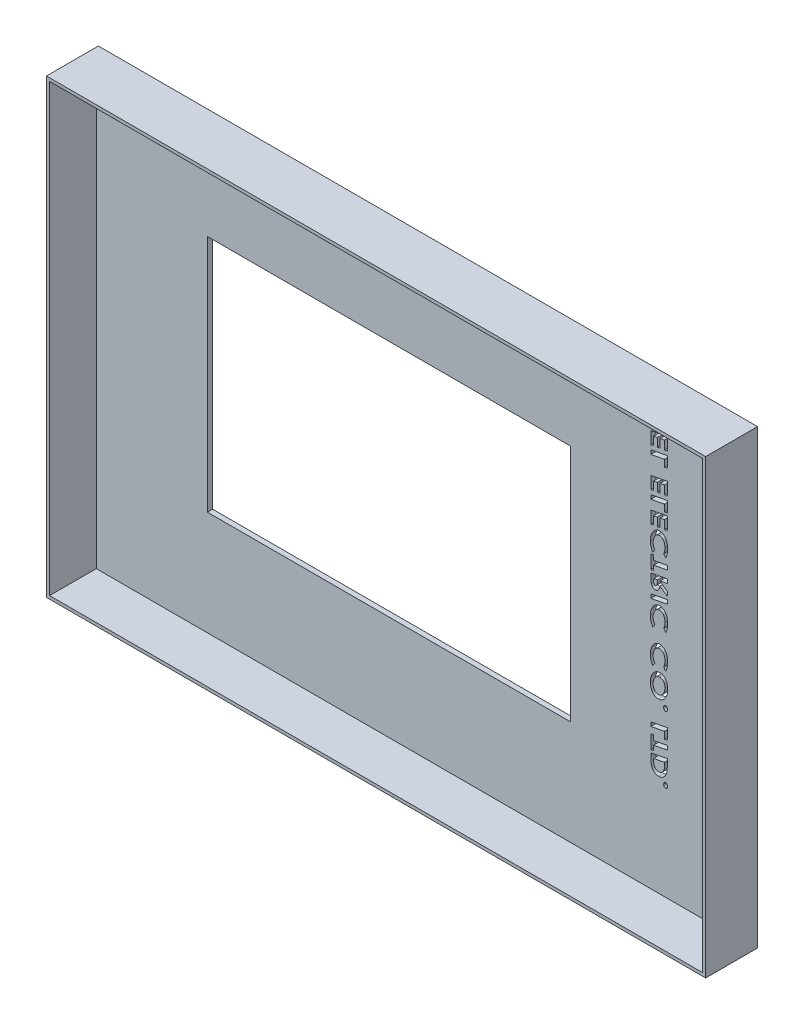
from build123d import *

# Parameters (mm, degrees)
SKETCH1_W           = 127
SKETCH1_H           = 87
SKETCH1_W_2         = 70
SKETCH1_H_2         = 45
BOSS_EXTRUDE1_DEPTH = 10
SKETCH2_W           = 125.8
SKETCH2_H           = 85.8
CUT_EXTRUDE1_DEPTH  = 9
SKETCH3_W           = 70
SKETCH3_H           = 45
CUT_EXTRUDE2_DEPTH  = 9


with BuildPart() as part:
    # Sketch1 → Boss-Extrude1 (new body)
    with BuildSketch(Plane.XY):
        with Locations((15.151215805, -8.661854103)):
            Rectangle(SKETCH1_W, SKETCH1_H)
        with Locations((8.651215805, -8.934429786)):
            Rectangle(SKETCH1_W_2, SKETCH1_H_2, mode=Mode.SUBTRACT)
    extrude(amount=BOSS_EXTRUDE1_DEPTH)

    # Sketch2 → Cut-Extrude1 (cut)
    with BuildSketch(Plane.XY.offset(10)):
        with Locations((15.151215805, -8.661854103)):
            Rectangle(SKETCH2_W, SKETCH2_H)
    extrude(amount=-CUT_EXTRUDE1_DEPTH, mode=Mode.SUBTRACT)

    # Sketch3 → Cut-Extrude2 (cut)
    # profile 1 of 21: a face of its own
    with BuildSketch(Plane(origin=(0, 0, 0), x_dir=(-1, 0, 0), z_dir=(0, 0, -1))):
        with Locations((-8.651215805, -7.938571366)):
            Rectangle(SKETCH3_W, SKETCH3_H)
    # profile 2 of 21: a face of its own
    with BuildSketch(Plane(origin=(0, 0, 0), x_dir=(-1, 0, 0), z_dir=(0, 0, -1))):
        with BuildLine():
            Line((-59.082117383, 34.027223421), (-59.082117383, 33.269726426))
            add(Edge.make_bspline(
                [(-59.082117383, 33.269726426), (-59.082281705, 33.214389143), (-59.082598447, 33.10772301), (-59.087222218, 32.954203937), (-59.094033499, 32.813175952), (-59.10344359, 32.685074316), (-59.115121237, 32.569376597), (-59.130416089, 32.466721027), (-59.14738296, 32.376206554), (-59.16314809, 32.321119835), (-59.170523833, 32.295347419)],
                knots=[0, 0, 0, 0, 1.353389102, 2.608743628, 3.756101744, 4.806405415, 5.750091809, 6.599269946, 7.344666056, 8, 8, 8, 8], degree=3))
            add(Edge.make_bspline(
                [(-59.170523833, 32.295347419), (-59.179710854, 32.26681277), (-59.197647814, 32.211101032), (-59.229885614, 32.131488105), (-59.264077544, 32.056883702), (-59.300996758, 31.987416608), (-59.340244289, 31.923083946), (-59.382423523, 31.864094565), (-59.427460533, 31.810647833), (-59.475462056, 31.762707565), (-59.525576689, 31.720042703), (-59.577901531, 31.682940202), (-59.632180729, 31.651591615), (-59.688569512, 31.625889243), (-59.747390949, 31.606012208), (-59.808416788, 31.592507636), (-59.871317046, 31.5827572), (-59.913989581, 31.582079624), (-59.93565304, 31.58173564)],
                knots=[0, 0, 0, 0, 1.276660213, 2.492582227, 3.656403132, 4.771545786, 5.841900154, 6.864511781, 7.857869233, 8.815819527, 9.751368605, 10.658498021, 11.544612112, 12.417650074, 13.294463908, 14.183977485, 15.078064426, 16, 16, 16, 16], degree=3))
            add(Edge.make_bspline(
                [(-59.93565304, 31.58173564), (-59.959431517, 31.582305882), (-60.006786131, 31.583441512), (-60.076741329, 31.593816113), (-60.144767079, 31.611346677), (-60.211317532, 31.634889718), (-60.276341978, 31.665498277), (-60.33932231, 31.703371178), (-60.400802657, 31.747374671), (-60.459535584, 31.798451164), (-60.516171299, 31.854540559), (-60.56794021, 31.916621383), (-60.616852014, 31.982364306), (-60.661152004, 32.053142404), (-60.702071397, 32.128485905), (-60.738779524, 32.208395682), (-60.771270148, 32.2930008), (-60.800583245, 32.383497212), (-60.825543255, 32.484468397), (-60.847487665, 32.598685738), (-60.866330412, 32.728156906), (-60.881984123, 32.872638741), (-60.894536665, 33.032142444), (-60.903712669, 33.206903173), (-60.910932391, 33.396666012), (-60.912852685, 33.528366746), (-60.913848152, 33.596639486)],
                knots=[0, 0, 0, 0, 0.688190827, 1.37052554, 2.041977379, 2.71957408, 3.41155978, 4.119000826, 4.844714822, 5.597744924, 6.37036061, 7.150040052, 7.935785256, 8.741326349, 9.565342852, 10.416796577, 11.285446487, 12.188132211, 13.169247335, 14.294861793, 15.55450045, 16.956352973, 18.501986645, 20.186439608, 22.023076926, 24, 24, 24, 24], degree=3))
            Line((-60.913848152, 33.596639486), (-62.257117383, 33.853590608))
            Line((-62.257117383, 33.853590608), (-62.257117383, 34.634620256))
            Line((-62.257117383, 34.634620256), (-59.082117383, 34.027223421))
        make_face()
        with BuildLine():
            add(Edge.make_bspline(
                [(-60.384681485, 33.494876666), (-60.384010222, 33.438480919), (-60.382727995, 33.33075554), (-60.378127954, 33.176755292), (-60.369195299, 33.038050622), (-60.357543886, 32.91473616), (-60.342331358, 32.806711971), (-60.324813557, 32.71379399), (-60.302548877, 32.636438765), (-60.27807618, 32.572598986), (-60.247974525, 32.521231007), (-60.216995847, 32.47652916), (-60.182136562, 32.43871594), (-60.14324807, 32.408403774), (-60.101483949, 32.384570028), (-60.056347969, 32.367085845), (-60.007777729, 32.356773727), (-59.974287143, 32.355685682), (-59.957277639, 32.355133076)],
                knots=[0, 0, 0, 0, 2.01570491, 3.850336042, 5.505520641, 6.982487919, 8.275845569, 9.403696488, 10.358095419, 11.150243365, 11.83912391, 12.480353238, 13.091510883, 13.669004126, 14.235709656, 14.804185275, 15.392658741, 16, 16, 16, 16], degree=3))
            add(Edge.make_bspline(
                [(-59.957277639, 32.355133076), (-59.938303657, 32.356044155), (-59.900923794, 32.357839035), (-59.847298148, 32.374058721), (-59.799113801, 32.402003431), (-59.755377909, 32.439163363), (-59.717444131, 32.487447027), (-59.685945505, 32.545844899), (-59.660569054, 32.614150203), (-59.645084989, 32.67879432), (-59.635134863, 32.739312639), (-59.629216797, 32.796250471), (-59.623370875, 32.863235322), (-59.619290886, 32.940459422), (-59.615290699, 33.027584085), (-59.61288525, 33.124914278), (-59.611785423, 33.232410699), (-59.611456132, 33.307463229), (-59.61128405, 33.346684559)],
                knots=[0, 0, 0, 0, 0.784179952, 1.544880747, 2.291583166, 3.075910414, 3.906448518, 4.817636112, 5.811880456, 6.914401306, 7.563619973, 8.349565657, 9.283129306, 10.346755864, 11.550169543, 12.893299621, 14.376484841, 16, 16, 16, 16], degree=3))
            Line((-59.61128405, 33.346684559), (-60.384681485, 33.494876666))
        make_face(mode=Mode.SUBTRACT)
    # profile 3 of 21: a face of its own
    with BuildSketch(Plane(origin=(0, 0, 0), x_dir=(-1, 0, 0), z_dir=(0, 0, -1))):
        Polygon((-59.082117383, 30.64869778), (-59.082117383, 29.867668132), (-62.257117383, 30.475064967), (-62.257117383, 31.256094615), align=None)
    # profile 4 of 21: a face of its own
    with BuildSketch(Plane(origin=(0, 0, 0), x_dir=(-1, 0, 0), z_dir=(0, 0, -1))):
        Polygon((-59.082117383, 29.038301145), (-59.082117383, 28.189217611), (-60.057768425, 27.579912724), (-59.082117383, 26.629066369), (-59.082117383, 25.679492051), (-60.651808889, 27.209114446), (-62.257117383, 26.206114647), (-62.257117383, 27.055834198), (-61.182883609, 27.726196778), (-62.257117383, 28.773081794), (-62.257117383, 29.722656113), (-60.588843144, 28.097631073), align=None)
    # profile 5 of 21: a face of its own
    with BuildSketch(Plane(origin=(0, 0, 0), x_dir=(-1, 0, 0), z_dir=(0, 0, -1))):
        Polygon((-59.082117383, 24.909274703), (-59.082117383, 22.545197179), (-59.61128405, 22.630423541), (-59.61128405, 24.230007876), (-60.343976357, 24.369931754), (-60.343976357, 22.748086802), (-60.873143024, 22.833313164), (-60.873143024, 24.471058557), (-61.727950716, 24.634515087), (-61.727950716, 22.970056954), (-62.257117383, 23.055283317), (-62.257117383, 25.516671538), align=None)
    # profile 6 of 21: a face of its own
    with BuildSketch(Plane(origin=(0, 0, 0), x_dir=(-1, 0, 0), z_dir=(0, 0, -1))):
        Polygon((-59.082117383, 21.693569575), (-59.082117383, 20.912539927), (-61.727950716, 21.418809959), (-61.727950716, 20.102889486), (-62.257117383, 20.197020095), (-62.257117383, 22.300966409), align=None)
    # profile 7 of 21: a face of its own
    with BuildSketch(Plane(origin=(0, 0, 0), x_dir=(-1, 0, 0), z_dir=(0, 0, -1))):
        Polygon((-59.082117383, 17.419531113), (-59.082117383, 15.055453589), (-59.61128405, 15.140679951), (-59.61128405, 16.740264286), (-60.343976357, 16.880188164), (-60.343976357, 15.258343212), (-60.873143024, 15.343569575), (-60.873143024, 16.981314967), (-61.727950716, 17.144771498), (-61.727950716, 15.480313365), (-62.257117383, 15.565539727), (-62.257117383, 18.026927948), align=None)
    # profile 8 of 21: a face of its own
    with BuildSketch(Plane(origin=(0, 0, 0), x_dir=(-1, 0, 0), z_dir=(0, 0, -1))):
        Polygon((-59.082117383, 14.203825985), (-59.082117383, 13.422796337), (-61.727950716, 13.929066369), (-61.727950716, 12.613145897), (-62.257117383, 12.707276506), (-62.257117383, 14.81122282), align=None)
    # profile 9 of 21: a face of its own
    with BuildSketch(Plane(origin=(0, 0, 0), x_dir=(-1, 0, 0), z_dir=(0, 0, -1))):
        Polygon((-59.082117383, 11.639402908), (-59.082117383, 9.275325384), (-59.61128405, 9.360551746), (-59.61128405, 10.960136081), (-60.343976357, 11.100059959), (-60.343976357, 9.478215007), (-60.873143024, 9.563441369), (-60.873143024, 11.201186762), (-61.727950716, 11.364643292), (-61.727950716, 9.700185159), (-62.257117383, 9.785411522), (-62.257117383, 12.246799743), align=None)
    # profile 10 of 21: a face of its own
    with BuildSketch(Plane(origin=(0, 0, 0), x_dir=(-1, 0, 0), z_dir=(0, 0, -1))):
        with BuildLine():
            Line((-59.481536453, 4.767868453), (-59.875231365, 5.366997059))
            add(Edge.make_bspline(
                [(-59.875231365, 5.366997059), (-59.848355085, 5.400561155), (-59.793860494, 5.468616025), (-59.725853107, 5.583001145), (-59.666122741, 5.707180977), (-59.617246147, 5.841771645), (-59.577716864, 5.984621246), (-59.550034939, 6.134435713), (-59.533197508, 6.290108109), (-59.530993163, 6.395818945), (-59.529873793, 6.449499062)],
                knots=[0, 0, 0, 0, 0.889190196, 1.802930154, 2.747117594, 3.738502628, 4.762768697, 5.81204048, 6.88895098, 8, 8, 8, 8], degree=3))
            add(Edge.make_bspline(
                [(-59.529873793, 6.449499062), (-59.530323062, 6.487462257), (-59.531220167, 6.563267661), (-59.539682802, 6.67621808), (-59.553849061, 6.788026965), (-59.572962499, 6.898586517), (-59.596765192, 7.008323772), (-59.627730247, 7.116374588), (-59.663330759, 7.223343636), (-59.703711522, 7.328562172), (-59.749083765, 7.429977155), (-59.798396816, 7.526406051), (-59.850094873, 7.617505896), (-59.906307609, 7.702420699), (-59.966230077, 7.781243815), (-60.028957949, 7.854882612), (-60.096366068, 7.92156577), (-60.165702147, 7.983424063), (-60.238291673, 8.037883344), (-60.31188098, 8.085784326), (-60.386944551, 8.1262693), (-60.463073298, 8.159395962), (-60.540801004, 8.185064866), (-60.619518294, 8.20354097), (-60.699618065, 8.214652616), (-60.753325615, 8.216210208), (-60.78028445, 8.216992051)],
                knots=[0, 0, 0, 0, 1.147840019, 2.292021974, 3.422762477, 4.554719973, 5.683987435, 6.816453138, 7.951746113, 9.092312325, 10.222980131, 11.309625257, 12.366415312, 13.388810317, 14.386361657, 15.359174227, 16.311146327, 17.251367513, 18.166849566, 19.052414659, 19.904318703, 20.742752482, 21.559760478, 22.376164587, 23.184905847, 24, 24, 24, 24], degree=3))
            add(Edge.make_bspline(
                [(-60.78028445, 8.216992051), (-60.816409052, 8.21579735), (-60.887691761, 8.213439913), (-60.992336905, 8.193842415), (-61.092160645, 8.161269105), (-61.187213051, 8.115522636), (-61.277407498, 8.056999678), (-61.363244173, 7.985946562), (-61.443354497, 7.901031018), (-61.518382154, 7.804917657), (-61.586842959, 7.698998463), (-61.64691957, 7.584795081), (-61.696875409, 7.462792652), (-61.738446833, 7.334005189), (-61.770057896, 7.197786799), (-61.792635359, 7.054531513), (-61.80713893, 6.903913762), (-61.808609103, 6.801039045), (-61.809360973, 6.748427347)],
                knots=[0, 0, 0, 0, 0.869574001, 1.715883025, 2.553956626, 3.392154666, 4.249072723, 5.137586094, 6.069401023, 7.055131331, 8.070671864, 9.103069627, 10.158509107, 11.242070938, 12.359280707, 13.522814689, 14.733129686, 16, 16, 16, 16], degree=3))
            add(Edge.make_bspline(
                [(-61.809360973, 6.748427347), (-61.808646166, 6.692014224), (-61.807236543, 6.580765556), (-61.795559572, 6.416888098), (-61.776641767, 6.258717048), (-61.749973082, 6.106462028), (-61.715722794, 5.95988665), (-61.673625627, 5.819102266), (-61.624495537, 5.683723372), (-61.584805309, 5.597409486), (-61.565130203, 5.554622259)],
                knots=[0, 0, 0, 0, 1.101721473, 2.17263358, 3.207027447, 4.211833084, 5.190103856, 6.145147665, 7.080518871, 8, 8, 8, 8], degree=3))
            Line((-61.565130203, 5.554622259), (-61.958189098, 5.068068773))
            add(Edge.make_bspline(
                [(-61.958189098, 5.068068773), (-61.988708487, 5.13022897), (-62.050104113, 5.255276171), (-62.12743052, 5.451071767), (-62.192055674, 5.654407214), (-62.245481413, 5.864675766), (-62.287583389, 6.081884999), (-62.317209079, 6.306366497), (-62.335500627, 6.538234205), (-62.337508672, 6.695391707), (-62.338527639, 6.775140087)],
                knots=[0, 0, 0, 0, 0.941037308, 1.893077683, 2.85825254, 3.839602552, 4.840564537, 5.863992427, 6.916099189, 8, 8, 8, 8], degree=3))
            add(Edge.make_bspline(
                [(-62.338527639, 6.775140087), (-62.337898286, 6.830910391), (-62.336662693, 6.940402825), (-62.327509297, 7.101428162), (-62.313272597, 7.256173442), (-62.292261611, 7.40429373), (-62.265448896, 7.546042947), (-62.233518491, 7.681474249), (-62.194323539, 7.810418296), (-62.15005881, 7.933270611), (-62.099632282, 8.050050911), (-62.043663165, 8.16098409), (-61.98199, 8.265887622), (-61.91501073, 8.365002164), (-61.842347008, 8.458090811), (-61.763934031, 8.54542938), (-61.680035337, 8.62688542), (-61.591017081, 8.701646798), (-61.498921233, 8.769876281), (-61.403252371, 8.828171897), (-61.306248693, 8.878262866), (-61.207155582, 8.919296352), (-61.106008187, 8.950973968), (-61.002911751, 8.974257128), (-60.897887342, 8.987776679), (-60.827175277, 8.989517132), (-60.791732767, 8.990389486)],
                knots=[0, 0, 0, 0, 1.335548297, 2.622048338, 3.861325194, 5.056121889, 6.203257455, 7.315271413, 8.38661147, 9.428974541, 10.44098421, 11.43097564, 12.40275473, 13.353292526, 14.293769995, 15.228556463, 16.162101166, 17.091716535, 18.010748179, 18.904164555, 19.771580794, 20.622994739, 21.469245976, 22.30686302, 23.151360903, 24, 24, 24, 24], degree=3))
            add(Edge.make_bspline(
                [(-60.791732767, 8.990389486), (-60.753506478, 8.989531992), (-60.677115178, 8.987818379), (-60.563305416, 8.97011674), (-60.450691617, 8.943665434), (-60.339034415, 8.906458003), (-60.229028351, 8.858006773), (-60.120596066, 8.798070158), (-60.012758788, 8.728774341), (-59.907313662, 8.648573367), (-59.804336175, 8.560369278), (-59.707910287, 8.462322362), (-59.615983404, 8.357790825), (-59.529096481, 8.245846254), (-59.449338536, 8.125294801), (-59.374752273, 7.99760404), (-59.305286932, 7.862680549), (-59.242313183, 7.720653538), (-59.184736906, 7.573649391), (-59.136258032, 7.421949757), (-59.094041619, 7.267339215), (-59.059501439, 7.109451437), (-59.033834043, 6.9482003), (-59.014573265, 6.783782307), (-59.002878634, 6.615882338), (-59.001434979, 6.502730863), (-59.000707126, 6.445682956)],
                knots=[0, 0, 0, 0, 0.802908214, 1.604529318, 2.415178512, 3.232499929, 4.074533496, 4.938036939, 5.834187948, 6.766429277, 7.720556171, 8.681619622, 9.654174899, 10.645336845, 11.657561967, 12.690103532, 13.752372777, 14.845514684, 15.954419799, 17.069120757, 18.191208037, 19.322240958, 20.464368269, 21.621814779, 22.800983469, 24, 24, 24, 24], degree=3))
            add(Edge.make_bspline(
                [(-59.000707126, 6.445682956), (-59.002182485, 6.366128627), (-59.005087966, 6.209459214), (-59.02777615, 5.978636114), (-59.064991186, 5.756025433), (-59.11799082, 5.5417861), (-59.185425492, 5.335399788), (-59.268204036, 5.137338028), (-59.366119633, 4.947216197), (-59.443028263, 4.827706846), (-59.481536453, 4.767868453)],
                knots=[0, 0, 0, 0, 1.077363834, 2.121694222, 3.138067454, 4.131892869, 5.108055193, 6.07597234, 7.036638365, 8, 8, 8, 8], degree=3))
        make_face()
    # profile 11 of 21: a face of its own
    with BuildSketch(Plane(origin=(0, 0, 0), x_dir=(-1, 0, 0), z_dir=(0, 0, -1))):
        Polygon((-59.082117383, 4.350004871), (-59.082117383, 1.704171538), (-59.61128405, 1.798302147), (-59.61128405, 2.704627267), (-62.257117383, 3.203265087), (-62.257117383, 3.983658717), (-59.61128405, 3.485020897), (-59.61128405, 4.449859639), align=None)
    # profile 12 of 21: a face of its own
    with BuildSketch(Plane(origin=(0, 0, 0), x_dir=(-1, 0, 0), z_dir=(0, 0, -1))):
        with BuildLine():
            Line((-59.082117383, 1.137479831), (-59.082117383, 0.398427347))
            add(Edge.make_bspline(
                [(-59.082117383, 0.398427347), (-59.08228303, 0.34351424), (-59.082602235, 0.237696278), (-59.087204361, 0.08544634), (-59.094070855, -0.054090448), (-59.103256949, -0.180971463), (-59.115887193, -0.295102733), (-59.130924983, -0.396805374), (-59.148617469, -0.485749437), (-59.164455714, -0.539998094), (-59.171795868, -0.56513936)],
                knots=[0, 0, 0, 0, 1.357552076, 2.616012828, 3.765317172, 4.811306205, 5.760556428, 6.603372588, 7.352740091, 8, 8, 8, 8], degree=3))
            add(Edge.make_bspline(
                [(-59.171795868, -0.56513936), (-59.181256753, -0.593440854), (-59.199705976, -0.648630262), (-59.231664909, -0.72788375), (-59.26647009, -0.801601051), (-59.304376676, -0.870018485), (-59.343866948, -0.933547436), (-59.386882375, -0.991378736), (-59.432792926, -1.04351053), (-59.480960076, -1.090903635), (-59.532220224, -1.132086922), (-59.584834281, -1.168985445), (-59.640828049, -1.198796877), (-59.698733978, -1.223584057), (-59.75884548, -1.243651346), (-59.82129632, -1.257439007), (-59.886012767, -1.266053793), (-59.929901294, -1.266882151), (-59.952189498, -1.267302821)],
                knots=[0, 0, 0, 0, 1.266007356, 2.46878121, 3.623671115, 4.722876152, 5.786116538, 6.795472662, 7.777148764, 8.731402058, 9.658687144, 10.564471779, 11.454028862, 12.344676981, 13.23509791, 14.138646147, 15.054736234, 16, 16, 16, 16], degree=3))
            add(Edge.make_bspline(
                [(-59.952189498, -1.267302821), (-59.979587018, -1.266416676), (-60.033830692, -1.264662219), (-60.113615302, -1.251601889), (-60.190560797, -1.230460498), (-60.264809104, -1.201262452), (-60.335639568, -1.162643163), (-60.403395312, -1.115925963), (-60.468068257, -1.0606246), (-60.529576835, -0.996957691), (-60.587887214, -0.924992186), (-60.64042284, -0.843306971), (-60.689513634, -0.753792671), (-60.733127696, -0.655305029), (-60.772596855, -0.548668376), (-60.807571959, -0.43338265), (-60.837135328, -0.309205904), (-60.853358589, -0.223246046), (-60.861694707, -0.179076659)],
                knots=[0, 0, 0, 0, 0.847847708, 1.678632812, 2.49540581, 3.314364281, 4.142449158, 4.987115915, 5.857696543, 6.772001895, 7.724174609, 8.719863072, 9.774210358, 10.881692672, 12.05077541, 13.292274086, 14.60866928, 16, 16, 16, 16], degree=3))
            Line((-60.861694707, -0.179076659), (-62.257117383, -1.143915401))
            Line((-62.257117383, -1.143915401), (-62.257117383, -0.323452661))
            Line((-62.257117383, -0.323452661), (-60.873143024, 0.633117852))
            Line((-60.873143024, 0.633117852), (-60.873143024, 0.699263685))
            Line((-60.873143024, 0.699263685), (-62.257117383, 0.963847018))
            Line((-62.257117383, 0.963847018), (-62.257117383, 1.744876666))
            Line((-62.257117383, 1.744876666), (-59.082117383, 1.137479831))
        make_face()
        with BuildLine():
            add(Edge.make_bspline(
                [(-60.343976357, 0.597500865), (-60.34360149, 0.543222638), (-60.34288672, 0.439728913), (-60.337795176, 0.291913106), (-60.329866259, 0.158897359), (-60.318382344, 0.040553862), (-60.305012779, -0.063137663), (-60.288039662, -0.151979774), (-60.26850362, -0.226126673), (-60.244445239, -0.286632354), (-60.217175833, -0.336213609), (-60.186859365, -0.378119361), (-60.154076059, -0.413985299), (-60.117579632, -0.443281391), (-60.078257972, -0.466363009), (-60.035231527, -0.482466832), (-59.989301088, -0.49214665), (-59.95753701, -0.493312344), (-59.941377199, -0.493905385)],
                knots=[0, 0, 0, 0, 2.030592, 3.871783324, 5.532661145, 7.014803794, 8.319353416, 9.442431818, 10.396846624, 11.183341516, 11.872054959, 12.508254593, 13.114375564, 13.684172116, 14.252808241, 14.812580223, 15.395906282, 16, 16, 16, 16], degree=3))
            add(Edge.make_bspline(
                [(-59.941377199, -0.493905385), (-59.923036458, -0.492975672), (-59.887163206, -0.491157215), (-59.8355473, -0.475338032), (-59.789233375, -0.448641703), (-59.747679021, -0.412160569), (-59.712049482, -0.365573463), (-59.68227713, -0.309865401), (-59.659104075, -0.245020127), (-59.643460792, -0.184311122), (-59.634702709, -0.126836772), (-59.628545107, -0.072940997), (-59.622717349, -0.008915855), (-59.618471936, 0.065114802), (-59.615556325, 0.149095499), (-59.612791319, 0.243010802), (-59.611813079, 0.346908195), (-59.611465457, 0.419628044), (-59.61128405, 0.457576986)],
                knots=[0, 0, 0, 0, 0.79085928, 1.546867379, 2.305532419, 3.084212401, 3.919414283, 4.824844153, 5.80116134, 6.887124538, 7.526901634, 8.310572345, 9.229923887, 10.303150806, 11.512676427, 12.859181083, 14.360959786, 16, 16, 16, 16], degree=3))
            Line((-59.61128405, 0.457576986), (-60.343976357, 0.597500865))
        make_face(mode=Mode.SUBTRACT)
    # profile 13 of 21: a face of its own
    with BuildSketch(Plane(origin=(0, 0, 0), x_dir=(-1, 0, 0), z_dir=(0, 0, -1))):
        Polygon((-59.082117383, -2.322456066), (-59.082117383, -3.103485714), (-62.257117383, -2.496088879), (-62.257117383, -1.715059232), align=None)
    # profile 14 of 21: a face of its own
    with BuildSketch(Plane(origin=(0, 0, 0), x_dir=(-1, 0, 0), z_dir=(0, 0, -1))):
        with BuildLine():
            Line((-59.481536453, -7.687900778), (-59.875231365, -7.088772172))
            add(Edge.make_bspline(
                [(-59.875231365, -7.088772172), (-59.848355085, -7.055208075), (-59.793860494, -6.987153206), (-59.725853107, -6.872768086), (-59.666122741, -6.748588254), (-59.617246147, -6.613997585), (-59.577716864, -6.471147984), (-59.550034939, -6.321333517), (-59.533197508, -6.165661122), (-59.530993163, -6.059950285), (-59.529873793, -6.006270169)],
                knots=[0, 0, 0, 0, 0.889190196, 1.802930154, 2.747117594, 3.738502628, 4.762768697, 5.81204048, 6.88895098, 8, 8, 8, 8], degree=3))
            add(Edge.make_bspline(
                [(-59.529873793, -6.006270169), (-59.530323062, -5.968306974), (-59.531220167, -5.89250157), (-59.539682802, -5.77955115), (-59.553849061, -5.667742266), (-59.572962499, -5.557182714), (-59.596765192, -5.447445459), (-59.627730247, -5.339394643), (-59.663330759, -5.232425595), (-59.703711522, -5.127207059), (-59.749083765, -5.025792075), (-59.798396816, -4.92936318), (-59.850094873, -4.838263334), (-59.906307609, -4.753348532), (-59.966230077, -4.674525415), (-60.028957949, -4.600886619), (-60.096366068, -4.534203461), (-60.165702147, -4.472345168), (-60.238291673, -4.417885887), (-60.31188098, -4.369984905), (-60.386944551, -4.32949993), (-60.463073298, -4.296373269), (-60.540801004, -4.270704365), (-60.619518294, -4.252228261), (-60.699618065, -4.241116614), (-60.753325615, -4.239559023), (-60.78028445, -4.23877718)],
                knots=[0, 0, 0, 0, 1.147840019, 2.292021974, 3.422762477, 4.554719973, 5.683987435, 6.816453138, 7.951746113, 9.092312325, 10.222980131, 11.309625257, 12.366415312, 13.388810317, 14.386361657, 15.359174227, 16.311146327, 17.251367513, 18.166849566, 19.052414659, 19.904318703, 20.742752482, 21.559760478, 22.376164587, 23.184905847, 24, 24, 24, 24], degree=3))
            add(Edge.make_bspline(
                [(-60.78028445, -4.23877718), (-60.816409052, -4.239971881), (-60.887691761, -4.242329318), (-60.992336905, -4.261926816), (-61.092160645, -4.294500126), (-61.187213051, -4.340246595), (-61.277407498, -4.398769553), (-61.363244173, -4.469822669), (-61.443354497, -4.554738212), (-61.518382154, -4.650851573), (-61.586842959, -4.756770768), (-61.64691957, -4.870974149), (-61.696875409, -4.992976578), (-61.738446833, -5.121764042), (-61.770057896, -5.257982432), (-61.792635359, -5.401237718), (-61.80713893, -5.551855469), (-61.808609103, -5.654730186), (-61.809360973, -5.707341884)],
                knots=[0, 0, 0, 0, 0.869574001, 1.715883025, 2.553956626, 3.392154666, 4.249072723, 5.137586094, 6.069401023, 7.055131331, 8.070671864, 9.103069627, 10.158509107, 11.242070938, 12.359280707, 13.522814689, 14.733129686, 16, 16, 16, 16], degree=3))
            add(Edge.make_bspline(
                [(-61.809360973, -5.707341884), (-61.808646166, -5.763755007), (-61.807236543, -5.875003675), (-61.795559572, -6.038881133), (-61.776641767, -6.197052182), (-61.749973082, -6.349307203), (-61.715722794, -6.495882581), (-61.673625627, -6.636666965), (-61.624495537, -6.772045859), (-61.584805309, -6.858359744), (-61.565130203, -6.901146972)],
                knots=[0, 0, 0, 0, 1.101721473, 2.17263358, 3.207027447, 4.211833084, 5.190103856, 6.145147665, 7.080518871, 8, 8, 8, 8], degree=3))
            Line((-61.565130203, -6.901146972), (-61.958189098, -7.387700458))
            add(Edge.make_bspline(
                [(-61.958189098, -7.387700458), (-61.988708487, -7.325540261), (-62.050104113, -7.200493059), (-62.12743052, -7.004697464), (-62.192055674, -6.801362017), (-62.245481413, -6.591093465), (-62.287583389, -6.373884231), (-62.317209079, -6.149402734), (-62.335500627, -5.917535026), (-62.337508672, -5.760377524), (-62.338527639, -5.680629143)],
                knots=[0, 0, 0, 0, 0.941037308, 1.893077683, 2.85825254, 3.839602552, 4.840564537, 5.863992427, 6.916099189, 8, 8, 8, 8], degree=3))
            add(Edge.make_bspline(
                [(-62.338527639, -5.680629143), (-62.337898286, -5.624858839), (-62.336662693, -5.515366406), (-62.327509297, -5.354341068), (-62.313272597, -5.199595789), (-62.292261611, -5.051475501), (-62.265448896, -4.909726284), (-62.233518491, -4.774294982), (-62.194323539, -4.645350934), (-62.15005881, -4.52249862), (-62.099632282, -4.40571832), (-62.043663165, -4.294785141), (-61.98199, -4.189881609), (-61.91501073, -4.090767067), (-61.842347008, -3.99767842), (-61.763934031, -3.910339851), (-61.680035337, -3.828883811), (-61.591017081, -3.754122433), (-61.498921233, -3.685892949), (-61.403252371, -3.627597334), (-61.306248693, -3.577506365), (-61.207155582, -3.536472878), (-61.106008187, -3.504795263), (-61.002911751, -3.481512102), (-60.897887342, -3.467992552), (-60.827175277, -3.466252099), (-60.791732767, -3.465379744)],
                knots=[0, 0, 0, 0, 1.335548297, 2.622048338, 3.861325194, 5.056121889, 6.203257455, 7.315271413, 8.38661147, 9.428974541, 10.44098421, 11.43097564, 12.40275473, 13.353292526, 14.293769995, 15.228556463, 16.162101166, 17.091716535, 18.010748179, 18.904164555, 19.771580794, 20.622994739, 21.469245976, 22.30686302, 23.151360903, 24, 24, 24, 24], degree=3))
            add(Edge.make_bspline(
                [(-60.791732767, -3.465379744), (-60.753506478, -3.466237239), (-60.677115178, -3.467950852), (-60.563305416, -3.48565249), (-60.450691617, -3.512103797), (-60.339034415, -3.549311228), (-60.229028351, -3.597762458), (-60.120596066, -3.657699072), (-60.012758788, -3.72699489), (-59.907313662, -3.807195864), (-59.804336175, -3.895399952), (-59.707910287, -3.993446868), (-59.615983404, -4.097978406), (-59.529096481, -4.209922977), (-59.449338536, -4.330474429), (-59.374752273, -4.458165191), (-59.305286932, -4.593088682), (-59.242313183, -4.735115693), (-59.184736906, -4.882119839), (-59.136258032, -5.033819473), (-59.094041619, -5.188430016), (-59.059501439, -5.346317794), (-59.033834043, -5.507568931), (-59.014573265, -5.671986924), (-59.002878634, -5.839886893), (-59.001434979, -5.953038368), (-59.000707126, -6.010086275)],
                knots=[0, 0, 0, 0, 0.802908214, 1.604529318, 2.415178512, 3.232499929, 4.074533496, 4.938036939, 5.834187948, 6.766429277, 7.720556171, 8.681619622, 9.654174899, 10.645336845, 11.657561967, 12.690103532, 13.752372777, 14.845514684, 15.954419799, 17.069120757, 18.191208037, 19.322240958, 20.464368269, 21.621814779, 22.800983469, 24, 24, 24, 24], degree=3))
            add(Edge.make_bspline(
                [(-59.000707126, -6.010086275), (-59.002182485, -6.089640604), (-59.005087966, -6.246310017), (-59.02777615, -6.477133117), (-59.064991186, -6.699743798), (-59.11799082, -6.913983131), (-59.185425492, -7.120369443), (-59.268204036, -7.318431203), (-59.366119633, -7.508553034), (-59.443028263, -7.628062385), (-59.481536453, -7.687900778)],
                knots=[0, 0, 0, 0, 1.077363834, 2.121694222, 3.138067454, 4.131892869, 5.108055193, 6.07597234, 7.036638365, 8, 8, 8, 8], degree=3))
        make_face()
    # profile 15 of 21: a face of its own
    with BuildSketch(Plane(origin=(0, 0, 0), x_dir=(-1, 0, 0), z_dir=(0, 0, -1))):
        with BuildLine():
            Line((-59.481536453, -14.119311034), (-59.875231365, -13.520182429))
            add(Edge.make_bspline(
                [(-59.875231365, -13.520182429), (-59.848355085, -13.486618332), (-59.793860494, -13.418563462), (-59.725853107, -13.304178343), (-59.666122741, -13.17999851), (-59.617246147, -13.045407842), (-59.577716864, -12.902558241), (-59.550034939, -12.752743774), (-59.533197508, -12.597071378), (-59.530993163, -12.491360542), (-59.529873793, -12.437680425)],
                knots=[0, 0, 0, 0, 0.889190196, 1.802930154, 2.747117594, 3.738502628, 4.762768697, 5.81204048, 6.88895098, 8, 8, 8, 8], degree=3))
            add(Edge.make_bspline(
                [(-59.529873793, -12.437680425), (-59.530323062, -12.399717231), (-59.531220167, -12.323911826), (-59.539682802, -12.210961407), (-59.553849061, -12.099152523), (-59.572962499, -11.98859297), (-59.596765192, -11.878855715), (-59.627730247, -11.770804899), (-59.663330759, -11.663835851), (-59.703711522, -11.558617315), (-59.749083765, -11.457202332), (-59.798396816, -11.360773436), (-59.850094873, -11.269673591), (-59.906307609, -11.184758788), (-59.966230077, -11.105935672), (-60.028957949, -11.032296876), (-60.096366068, -10.965613718), (-60.165702147, -10.903755424), (-60.238291673, -10.849296143), (-60.31188098, -10.801395161), (-60.386944551, -10.760910187), (-60.463073298, -10.727783525), (-60.540801004, -10.702114621), (-60.619518294, -10.683638517), (-60.699618065, -10.672526871), (-60.753325615, -10.670969279), (-60.78028445, -10.670187437)],
                knots=[0, 0, 0, 0, 1.147840019, 2.292021974, 3.422762477, 4.554719973, 5.683987435, 6.816453138, 7.951746113, 9.092312325, 10.222980131, 11.309625257, 12.366415312, 13.388810317, 14.386361657, 15.359174227, 16.311146327, 17.251367513, 18.166849566, 19.052414659, 19.904318703, 20.742752482, 21.559760478, 22.376164587, 23.184905847, 24, 24, 24, 24], degree=3))
            add(Edge.make_bspline(
                [(-60.78028445, -10.670187437), (-60.816409052, -10.671382137), (-60.887691761, -10.673739574), (-60.992336905, -10.693337073), (-61.092160645, -10.725910383), (-61.187213051, -10.771656852), (-61.277407498, -10.830179809), (-61.363244173, -10.901232925), (-61.443354497, -10.986148469), (-61.518382154, -11.08226183), (-61.586842959, -11.188181024), (-61.64691957, -11.302384406), (-61.696875409, -11.424386835), (-61.738446833, -11.553174299), (-61.770057896, -11.689392688), (-61.792635359, -11.832647974), (-61.80713893, -11.983265726), (-61.808609103, -12.086140442), (-61.809360973, -12.13875214)],
                knots=[0, 0, 0, 0, 0.869574001, 1.715883025, 2.553956626, 3.392154666, 4.249072723, 5.137586094, 6.069401023, 7.055131331, 8.070671864, 9.103069627, 10.158509107, 11.242070938, 12.359280707, 13.522814689, 14.733129686, 16, 16, 16, 16], degree=3))
            add(Edge.make_bspline(
                [(-61.809360973, -12.13875214), (-61.808646166, -12.195165264), (-61.807236543, -12.306413931), (-61.795559572, -12.470291389), (-61.776641767, -12.628462439), (-61.749973082, -12.780717459), (-61.715722794, -12.927292838), (-61.673625627, -13.068077221), (-61.624495537, -13.203456115), (-61.584805309, -13.289770001), (-61.565130203, -13.332557228)],
                knots=[0, 0, 0, 0, 1.101721473, 2.17263358, 3.207027447, 4.211833084, 5.190103856, 6.145147665, 7.080518871, 8, 8, 8, 8], degree=3))
            Line((-61.565130203, -13.332557228), (-61.958189098, -13.819110714))
            add(Edge.make_bspline(
                [(-61.958189098, -13.819110714), (-61.988708487, -13.756950517), (-62.050104113, -13.631903316), (-62.12743052, -13.43610772), (-62.192055674, -13.232772273), (-62.245481413, -13.022503721), (-62.287583389, -12.805294488), (-62.317209079, -12.580812991), (-62.335500627, -12.348945282), (-62.337508672, -12.19178778), (-62.338527639, -12.1120394)],
                knots=[0, 0, 0, 0, 0.941037308, 1.893077683, 2.85825254, 3.839602552, 4.840564537, 5.863992427, 6.916099189, 8, 8, 8, 8], degree=3))
            add(Edge.make_bspline(
                [(-62.338527639, -12.1120394), (-62.337898286, -12.056269096), (-62.336662693, -11.946776662), (-62.327509297, -11.785751325), (-62.313272597, -11.631006045), (-62.292261611, -11.482885757), (-62.265448896, -11.34113654), (-62.233518491, -11.205705238), (-62.194323539, -11.076761191), (-62.15005881, -10.953908876), (-62.099632282, -10.837128576), (-62.043663165, -10.726195397), (-61.98199, -10.621291866), (-61.91501073, -10.522177323), (-61.842347008, -10.429088676), (-61.763934031, -10.341750107), (-61.680035337, -10.260294067), (-61.591017081, -10.18553269), (-61.498921233, -10.117303206), (-61.403252371, -10.05900759), (-61.306248693, -10.008916621), (-61.207155582, -9.967883135), (-61.106008187, -9.936205519), (-61.002911751, -9.912922359), (-60.897887342, -9.899402808), (-60.827175277, -9.897662356), (-60.791732767, -9.896790001)],
                knots=[0, 0, 0, 0, 1.335548297, 2.622048338, 3.861325194, 5.056121889, 6.203257455, 7.315271413, 8.38661147, 9.428974541, 10.44098421, 11.43097564, 12.40275473, 13.353292526, 14.293769995, 15.228556463, 16.162101166, 17.091716535, 18.010748179, 18.904164555, 19.771580794, 20.622994739, 21.469245976, 22.30686302, 23.151360903, 24, 24, 24, 24], degree=3))
            add(Edge.make_bspline(
                [(-60.791732767, -9.896790001), (-60.753506478, -9.897647495), (-60.677115178, -9.899361109), (-60.563305416, -9.917062747), (-60.450691617, -9.943514053), (-60.339034415, -9.980721484), (-60.229028351, -10.029172714), (-60.120596066, -10.089109329), (-60.012758788, -10.158405146), (-59.907313662, -10.23860612), (-59.804336175, -10.326810209), (-59.707910287, -10.424857125), (-59.615983404, -10.529388662), (-59.529096481, -10.641333234), (-59.449338536, -10.761884686), (-59.374752273, -10.889575448), (-59.305286932, -11.024498938), (-59.242313183, -11.166525949), (-59.184736906, -11.313530096), (-59.136258032, -11.46522973), (-59.094041619, -11.619840272), (-59.059501439, -11.77772805), (-59.033834043, -11.938979187), (-59.014573265, -12.103397181), (-59.002878634, -12.271297149), (-59.001434979, -12.384448624), (-59.000707126, -12.441496531)],
                knots=[0, 0, 0, 0, 0.802908214, 1.604529318, 2.415178512, 3.232499929, 4.074533496, 4.938036939, 5.834187948, 6.766429277, 7.720556171, 8.681619622, 9.654174899, 10.645336845, 11.657561967, 12.690103532, 13.752372777, 14.845514684, 15.954419799, 17.069120757, 18.191208037, 19.322240958, 20.464368269, 21.621814779, 22.800983469, 24, 24, 24, 24], degree=3))
            add(Edge.make_bspline(
                [(-59.000707126, -12.441496531), (-59.002182485, -12.52105086), (-59.005087966, -12.677720273), (-59.02777615, -12.908543373), (-59.064991186, -13.131154055), (-59.11799082, -13.345393387), (-59.185425492, -13.551779699), (-59.268204036, -13.749841459), (-59.366119633, -13.93996329), (-59.443028263, -14.059472641), (-59.481536453, -14.119311034)],
                knots=[0, 0, 0, 0, 1.077363834, 2.121694222, 3.138067454, 4.131892869, 5.108055193, 6.07597234, 7.036638365, 8, 8, 8, 8], degree=3))
        make_face()
    # profile 16 of 21: a face of its own
    with BuildSketch(Plane(origin=(0, 0, 0), x_dir=(-1, 0, 0), z_dir=(0, 0, -1))):
        with BuildLine():
            add(Edge.make_bspline(
                [(-59.000707126, -17.140394768), (-59.001821376, -17.21273631), (-59.004001956, -17.354308245), (-59.024206334, -17.561732032), (-59.05686451, -17.759499678), (-59.10347407, -17.947624987), (-59.162285175, -18.126347729), (-59.235107954, -18.295126692), (-59.321242841, -18.454040965), (-59.403653808, -18.578285056), (-59.47455867, -18.671752749), (-59.530358879, -18.736803006), (-59.587214008, -18.797731339), (-59.646031763, -18.854254467), (-59.707073105, -18.905506285), (-59.769717082, -18.952822249), (-59.833606834, -18.996095328), (-59.899655739, -19.034622972), (-59.967577544, -19.068096236), (-60.037186806, -19.097526425), (-60.108455177, -19.122606955), (-60.181781217, -19.141854443), (-60.256607015, -19.158147207), (-60.333290313, -19.169574537), (-60.41192723, -19.17579375), (-60.464809586, -19.176966573), (-60.491532447, -19.177559232)],
                knots=[0, 0, 0, 0, 1.852392301, 3.625119903, 5.331906361, 6.982042517, 8.584084224, 10.145518371, 11.683494145, 13.207556267, 13.959082837, 14.687033946, 15.401556124, 16.092840337, 16.774871373, 17.441666774, 18.102800445, 18.750052864, 19.398420353, 20.040826083, 20.684790385, 21.331518741, 21.981158253, 22.645406299, 23.315487784, 24, 24, 24, 24], degree=3))
            add(Edge.make_bspline(
                [(-60.491532447, -19.177559232), (-60.532712963, -19.176635495), (-60.614748288, -19.174795328), (-60.736723256, -19.15826498), (-60.856956067, -19.13149585), (-60.975204625, -19.09382178), (-61.091781003, -19.045752381), (-61.20654403, -18.986886022), (-61.31959941, -18.917504461), (-61.43015607, -18.838030127), (-61.536004816, -18.749600984), (-61.636608658, -18.653641916), (-61.730404499, -18.550525482), (-61.81889848, -18.441022307), (-61.89933378, -18.323293653), (-61.974604254, -18.199565274), (-62.042721397, -18.068254629), (-62.104860923, -17.930728616), (-62.1603127, -17.786835401), (-62.20790696, -17.637277056), (-62.247834536, -17.48240735), (-62.280846381, -17.322567416), (-62.307092713, -17.157485604), (-62.325299892, -16.987026012), (-62.336238556, -16.811294131), (-62.3377578, -16.69244205), (-62.338527639, -16.632216683)],
                knots=[0, 0, 0, 0, 0.850089785, 1.693455987, 2.536844917, 3.391174577, 4.253010063, 5.138053448, 6.051878335, 6.989883427, 7.947335561, 8.898006822, 9.858696774, 10.824163535, 11.803008634, 12.800898744, 13.813329799, 14.85578846, 15.916041723, 16.99604336, 18.095116085, 19.217375693, 20.365445703, 21.545648831, 22.756317961, 24, 24, 24, 24], degree=3))
            add(Edge.make_bspline(
                [(-62.338527639, -16.632216683), (-62.337390339, -16.55754561), (-62.335173204, -16.41197652), (-62.315518574, -16.199560342), (-62.284848107, -15.998443518), (-62.24137516, -15.808830143), (-62.1845566, -15.630752493), (-62.115193121, -15.464325016), (-62.03382189, -15.309008602), (-61.955089196, -15.189148556), (-61.885826626, -15.100985278), (-61.833307106, -15.038143049), (-61.777865796, -14.98035569), (-61.720361889, -14.926847017), (-61.661550638, -14.877036538), (-61.599926681, -14.832272338), (-61.53638676, -14.791959441), (-61.471569811, -14.754291023), (-61.403878293, -14.723141473), (-61.334963516, -14.694559432), (-61.263695374, -14.671178266), (-61.1903358, -14.652244835), (-61.115238029, -14.636772297), (-61.037913903, -14.626051206), (-60.958695819, -14.619537868), (-60.905168356, -14.618903907), (-60.878231165, -14.618584873)],
                knots=[0, 0, 0, 0, 1.929455288, 3.761417063, 5.508120955, 7.184119289, 8.783491008, 10.333261166, 11.838126237, 13.309165487, 14.031443297, 14.735109514, 15.424922722, 16.099464992, 16.764527501, 17.415515072, 18.066041309, 18.708954447, 19.351120011, 19.990098629, 20.636388374, 21.287583438, 21.94736606, 22.616860194, 23.303947933, 24, 24, 24, 24], degree=3))
            add(Edge.make_bspline(
                [(-60.878231165, -14.618584873), (-60.847474485, -14.6190694), (-60.78629032, -14.620033268), (-60.695399961, -14.627899882), (-60.60619003, -14.64050878), (-60.518718631, -14.658484542), (-60.432577015, -14.681223697), (-60.348395975, -14.709939564), (-60.265659974, -14.743406911), (-60.184309025, -14.781001687), (-60.105445329, -14.825594449), (-60.027612539, -14.873929357), (-59.951057057, -14.926976166), (-59.877601493, -14.987097506), (-59.803894049, -15.049940853), (-59.733839753, -15.120030527), (-59.663777705, -15.193670693), (-59.619697228, -15.246297467), (-59.597291662, -15.273047012)],
                knots=[0, 0, 0, 0, 0.990615802, 1.970628883, 2.936428571, 3.89137446, 4.845538607, 5.804407962, 6.754261031, 7.719674322, 8.688776229, 9.670382268, 10.670719523, 11.686073146, 12.726831545, 13.789255101, 14.876305448, 16, 16, 16, 16], degree=3))
            add(Edge.make_bspline(
                [(-59.597291662, -15.273047012), (-59.572773714, -15.303736855), (-59.523836269, -15.364993308), (-59.456704115, -15.461575662), (-59.393400909, -15.560605865), (-59.335778004, -15.663539587), (-59.281418443, -15.768873107), (-59.232371994, -15.877787543), (-59.188878323, -15.990153733), (-59.148135151, -16.104964323), (-59.11450502, -16.223793166), (-59.083447548, -16.345129112), (-59.058324446, -16.470025395), (-59.037340701, -16.59794683), (-59.020625193, -16.729026003), (-59.009506537, -16.863363283), (-59.002254321, -17.000815395), (-59.001226584, -17.093532179), (-59.000707126, -17.140394768)],
                knots=[0, 0, 0, 0, 0.942306235, 1.880828727, 2.820728888, 3.761523452, 4.710247874, 5.664262938, 6.625937424, 7.600881067, 8.586148568, 9.587994516, 10.605615105, 11.641808371, 12.698061803, 13.775335515, 14.875569943, 16, 16, 16, 16], degree=3))
        make_face()
        with BuildLine():
            add(Edge.make_bspline(
                [(-59.529873793, -17.121950257), (-59.530301665, -17.083137517), (-59.531151389, -17.006058015), (-59.539794617, -16.891880366), (-59.553093664, -16.780029927), (-59.571475278, -16.670915413), (-59.594832886, -16.564228393), (-59.624517731, -16.460371845), (-59.658333919, -16.35860028), (-59.698894208, -16.260211943), (-59.742736651, -16.164841161), (-59.792577215, -16.074506874), (-59.846951254, -15.988693489), (-59.905895598, -15.90745177), (-59.96958971, -15.830907645), (-60.037996109, -15.759503286), (-60.110690632, -15.692388999), (-60.18764191, -15.630574934), (-60.267492649, -15.574976451), (-60.347894519, -15.525687664), (-60.42949581, -15.48474437), (-60.511442313, -15.450751636), (-60.594535714, -15.424796049), (-60.677976138, -15.405225093), (-60.762401454, -15.394403253), (-60.8188415, -15.392789381), (-60.847066301, -15.391982308)],
                knots=[0, 0, 0, 0, 1.162604496, 2.30885463, 3.428343695, 4.536223078, 5.622647463, 6.698380767, 7.770940504, 8.833638022, 9.885000488, 10.914023995, 11.921915242, 12.92684021, 13.918978248, 14.902806894, 15.887209441, 16.88113497, 17.857286262, 18.800608893, 19.703886933, 20.589689613, 21.455477945, 22.309065518, 23.154389613, 24, 24, 24, 24], degree=3))
            add(Edge.make_bspline(
                [(-60.847066301, -15.391982308), (-60.880002901, -15.392846533), (-60.945001034, -15.39455202), (-61.040398916, -15.411550193), (-61.132450592, -15.436331721), (-61.220384659, -15.473159216), (-61.304042621, -15.520661617), (-61.383941318, -15.578319353), (-61.459818237, -15.646279833), (-61.53156448, -15.723654952), (-61.597487379, -15.810692549), (-61.653857352, -15.908189295), (-61.702437822, -16.014167469), (-61.741701235, -16.129279268), (-61.772251227, -16.253358068), (-61.793243837, -16.386567327), (-61.80705076, -16.528680415), (-61.808576435, -16.626458246), (-61.809360973, -16.676737917)],
                knots=[0, 0, 0, 0, 0.878285005, 1.73323554, 2.578959788, 3.418642122, 4.270045791, 5.141669817, 6.043484478, 6.984500914, 7.954423775, 8.951163981, 9.984298254, 11.061616817, 12.192532202, 13.390773698, 14.658274179, 16, 16, 16, 16], degree=3))
            add(Edge.make_bspline(
                [(-61.809360973, -16.676737917), (-61.808349417, -16.735721768), (-61.806361515, -16.851636401), (-61.788072138, -17.022163186), (-61.758326755, -17.185866366), (-61.716986455, -17.34286037), (-61.664090315, -17.493160008), (-61.59916309, -17.63670219), (-61.521823209, -17.773168772), (-61.434149401, -17.90124586), (-61.338399816, -18.018543826), (-61.235912029, -18.121235799), (-61.128566755, -18.20908031), (-61.015259441, -18.279833959), (-60.897463492, -18.336136944), (-60.774070651, -18.375707378), (-60.645561472, -18.400013969), (-60.557996543, -18.402770352), (-60.513793064, -18.404161796)],
                knots=[0, 0, 0, 0, 1.183389714, 2.325588844, 3.437147295, 4.519690471, 5.580042994, 6.631093661, 7.677034148, 8.723779069, 9.74247063, 10.711186465, 11.630803362, 12.519692602, 13.385630574, 14.244041838, 15.11357823, 16, 16, 16, 16], degree=3))
            add(Edge.make_bspline(
                [(-60.513793064, -18.404161796), (-60.477476147, -18.403054709), (-60.406152175, -18.400880466), (-60.302210878, -18.384030754), (-60.203708471, -18.356660788), (-60.110802351, -18.317779587), (-60.024028829, -18.266676112), (-59.941762391, -18.206345104), (-59.86640195, -18.133261615), (-59.796864656, -18.050246823), (-59.734303582, -17.958259434), (-59.679309941, -17.859097477), (-59.632614723, -17.753160574), (-59.595525658, -17.639855206), (-59.565294784, -17.52009113), (-59.544642719, -17.393280137), (-59.532611028, -17.259776578), (-59.53080059, -17.168616704), (-59.529873793, -17.121950257)],
                knots=[0, 0, 0, 0, 0.961369072, 1.888063939, 2.78032683, 3.663499977, 4.546512507, 5.441438533, 6.358697666, 7.319066225, 8.304782526, 9.299966453, 10.31807076, 11.365549852, 12.453516721, 13.586014076, 14.764235371, 16, 16, 16, 16], degree=3))
        make_face(mode=Mode.SUBTRACT)
    # profile 17 of 21: a face of its own
    with BuildSketch(Plane(origin=(0, 0, 0), x_dir=(-1, 0, 0), z_dir=(0, 0, -1))):
        with BuildLine():
            add(Edge.make_bspline(
                [(-61.565130203, -20.073072052), (-61.566148304, -20.10542338), (-61.568132756, -20.168481594), (-61.589535672, -20.259155201), (-61.62238764, -20.343373583), (-61.661967739, -20.406268516), (-61.69829769, -20.451302772), (-61.727038321, -20.480952436), (-61.7574445, -20.505924112), (-61.789792781, -20.525680576), (-61.822895993, -20.541822933), (-61.857652166, -20.553634613), (-61.894161459, -20.559750828), (-61.918948737, -20.560935069), (-61.931476357, -20.561533591)],
                knots=[0, 0, 0, 0, 1.721288567, 3.355082735, 4.937221613, 6.520691562, 7.2919004, 8.019051844, 8.717908291, 9.382680806, 10.034653119, 10.677851231, 11.331779074, 12, 12, 12, 12], degree=3))
            add(Edge.make_bspline(
                [(-61.931476357, -20.561533591), (-61.943793786, -20.56094034), (-61.968163404, -20.559766613), (-62.004222481, -20.553539728), (-62.038785403, -20.541830004), (-62.071889581, -20.525680136), (-62.104228388, -20.505918389), (-62.134673973, -20.48097758), (-62.163349875, -20.451104581), (-62.200606749, -20.40663809), (-62.239594177, -20.343125148), (-62.273865234, -20.25943128), (-62.293749055, -20.168332944), (-62.296440418, -20.105393359), (-62.297822511, -20.073072052)],
                knots=[0, 0, 0, 0, 0.657642605, 1.301123782, 1.945002538, 2.59766478, 3.26314077, 3.962736759, 4.690657688, 5.469859043, 7.055004649, 8.643053602, 10.276110389, 12, 12, 12, 12], degree=3))
            add(Edge.make_bspline(
                [(-62.297822511, -20.073072052), (-62.296450726, -20.04032502), (-62.293787546, -19.976750049), (-62.273933501, -19.885027447), (-62.23981332, -19.8011453), (-62.193146357, -19.726845552), (-62.137597989, -19.6642563), (-62.074118409, -19.618400167), (-62.004591849, -19.589580535), (-61.955907669, -19.586271231), (-61.931476357, -19.584610514)],
                knots=[0, 0, 0, 0, 1.164019638, 2.259823604, 3.318264968, 4.36837637, 5.366452163, 6.2744366, 7.134055954, 8, 8, 8, 8], degree=3))
            add(Edge.make_bspline(
                [(-61.931476357, -19.584610514), (-61.918926251, -19.584850719), (-61.894043687, -19.585326964), (-61.857864851, -19.592957238), (-61.822753741, -19.603425997), (-61.789822272, -19.619913208), (-61.757410787, -19.639534691), (-61.727265932, -19.66457299), (-61.698069108, -19.693555958), (-61.662201074, -19.738567413), (-61.622183054, -19.800930877), (-61.589464203, -19.885294315), (-61.56809302, -19.976603976), (-61.566136864, -20.040295621), (-61.565130203, -20.073072052)],
                knots=[0, 0, 0, 0, 0.666782281, 1.322000986, 1.960978174, 2.61219893, 3.276205133, 3.974255977, 4.69254437, 5.462864202, 7.034935366, 8.615250444, 10.258170075, 12, 12, 12, 12], degree=3))
        make_face()
    # profile 18 of 21: a face of its own
    with BuildSketch(Plane(origin=(0, 0, 0), x_dir=(-1, 0, 0), z_dir=(0, 0, -1))):
        Polygon((-59.082117383, -23.692648374), (-59.082117383, -24.473678022), (-61.727950716, -23.96740799), (-61.727950716, -25.283328462), (-62.257117383, -25.189197853), (-62.257117383, -23.085251539), align=None)
    # profile 19 of 21: a face of its own
    with BuildSketch(Plane(origin=(0, 0, 0), x_dir=(-1, 0, 0), z_dir=(0, 0, -1))):
        Polygon((-59.082117383, -25.690379744), (-59.082117383, -28.336213078), (-59.61128405, -28.242082469), (-59.61128405, -27.335757349), (-62.257117383, -26.837119528), (-62.257117383, -26.056725898), (-59.61128405, -26.555363719), (-59.61128405, -25.590524977), align=None)
    # profile 20 of 21: a face of its own
    with BuildSketch(Plane(origin=(0, 0, 0), x_dir=(-1, 0, 0), z_dir=(0, 0, -1))):
        with BuildLine():
            Line((-59.082117383, -28.862199656), (-59.082117383, -29.547826659))
            add(Edge.make_bspline(
                [(-59.082117383, -29.547826659), (-59.082587776, -29.625638512), (-59.083496763, -29.776001996), (-59.090945524, -29.99383864), (-59.104231735, -30.196182635), (-59.122420618, -30.38330726), (-59.145583791, -30.555026101), (-59.174069466, -30.711269776), (-59.207112341, -30.852330441), (-59.247140833, -30.979199244), (-59.292468363, -31.095707253), (-59.34311492, -31.205315596), (-59.40087625, -31.308951226), (-59.462898407, -31.408072213), (-59.531811081, -31.50119111), (-59.607250841, -31.588381246), (-59.687965115, -31.670652973), (-59.774314561, -31.746663111), (-59.864684729, -31.816215941), (-59.959829317, -31.876311385), (-60.058649105, -31.926393557), (-60.160431332, -31.968183217), (-60.265726312, -32.000902567), (-60.374814865, -32.023367117), (-60.48710253, -32.038078092), (-60.563143603, -32.039607173), (-60.601563497, -32.040379744)],
                knots=[0, 0, 0, 0, 1.705867304, 3.296414899, 4.777654872, 6.150758428, 7.417410026, 8.575185326, 9.631488416, 10.591393249, 11.489044837, 12.370718983, 13.236133238, 14.088468319, 14.932538801, 15.772928605, 16.614307488, 17.457302361, 18.293013594, 19.111842669, 19.920437389, 20.71881538, 21.521511001, 22.333717709, 23.158107768, 24, 24, 24, 24], degree=3))
            add(Edge.make_bspline(
                [(-60.601563497, -32.040379744), (-60.641255144, -32.039369335), (-60.72026964, -32.037357904), (-60.837263765, -32.022204035), (-60.952179591, -31.998393924), (-61.063953438, -31.96270358), (-61.174048617, -31.919086632), (-61.280995088, -31.864473641), (-61.385817071, -31.800771546), (-61.486779163, -31.727014326), (-61.583489385, -31.646292249), (-61.673730704, -31.559355915), (-61.758437299, -31.46865089), (-61.834623261, -31.371307005), (-61.904728775, -31.269359247), (-61.968688779, -31.162600403), (-62.024411485, -31.049998714), (-62.074783804, -30.93194905), (-62.118374151, -30.805080083), (-62.155381553, -30.667726264), (-62.187423579, -30.518971628), (-62.21217345, -30.358330746), (-62.232509567, -30.186300886), (-62.247128881, -30.002582247), (-62.255052267, -29.807392561), (-62.256416238, -29.673340959), (-62.257117383, -29.604432228)],
                knots=[0, 0, 0, 0, 0.864887534, 1.721738888, 2.567302188, 3.419355596, 4.275708419, 5.14571586, 6.033302212, 6.946500007, 7.86827371, 8.776830122, 9.676091263, 10.570960891, 11.468165814, 12.371584438, 13.280845613, 14.204320317, 15.167330516, 16.201996438, 17.303163173, 18.482193048, 19.743140736, 21.078179833, 22.498049141, 24, 24, 24, 24], degree=3))
            Line((-62.257117383, -29.604432228), (-62.257117383, -28.254802821))
            Line((-62.257117383, -28.254802821), (-59.082117383, -28.862199656))
        make_face()
        with BuildLine():
            Line((-59.61128405, -29.542102501), (-61.727950716, -29.136959272))
            Line((-61.727950716, -29.136959272), (-61.727950716, -29.419351099))
            add(Edge.make_bspline(
                [(-61.727950716, -29.419351099), (-61.727752822, -29.471720378), (-61.727371398, -29.572657623), (-61.723176776, -29.718520732), (-61.7181726, -29.853234829), (-61.708862634, -29.976605901), (-61.698572087, -30.088884938), (-61.684968209, -30.189783925), (-61.670676786, -30.280058043), (-61.656862899, -30.335714883), (-61.650356566, -30.361929224)],
                knots=[0, 0, 0, 0, 1.325901174, 2.555559529, 3.694567664, 4.738637661, 5.687775269, 6.548674524, 7.316426491, 8, 8, 8, 8], degree=3))
            add(Edge.make_bspline(
                [(-61.650356566, -30.361929224), (-61.640915674, -30.395386858), (-61.62230511, -30.461340949), (-61.585810817, -30.555767355), (-61.547048768, -30.646247044), (-61.501362127, -30.7306165), (-61.452084402, -30.810911329), (-61.396075454, -30.884866736), (-61.337379644, -30.955650479), (-61.272364355, -31.019651999), (-61.203129894, -31.077363008), (-61.130523002, -31.12897848), (-61.053088175, -31.171860044), (-60.971315136, -31.205793594), (-60.886348409, -31.233544941), (-60.797368876, -31.253341607), (-60.704267438, -31.264834531), (-60.640816609, -31.266258431), (-60.608559691, -31.266982308)],
                knots=[0, 0, 0, 0, 1.116519443, 2.200963246, 3.250342722, 4.277481613, 5.281286637, 6.274610015, 7.255969311, 8.233917316, 9.201295437, 10.150119179, 11.092414296, 12.038887036, 12.991177659, 13.961430325, 14.96363883, 16, 16, 16, 16], degree=3))
            add(Edge.make_bspline(
                [(-60.608559691, -31.266982308), (-60.582034127, -31.266579777), (-60.530118987, -31.265791953), (-60.45403854, -31.257087192), (-60.381048471, -31.243901848), (-60.311299884, -31.225161863), (-60.245148708, -31.19977946), (-60.182112639, -31.169966681), (-60.121986707, -31.135098028), (-60.06585644, -31.093986221), (-60.013111147, -31.047819375), (-59.962658831, -30.997896438), (-59.916306331, -30.942514936), (-59.872151256, -30.883656006), (-59.832097077, -30.819331355), (-59.794755406, -30.750938153), (-59.760288089, -30.67812626), (-59.728960342, -30.60066181), (-59.700839137, -30.51771617), (-59.676742282, -30.428273001), (-59.656599817, -30.332475539), (-59.640303531, -30.230127316), (-59.626578361, -30.121358844), (-59.618411145, -30.005853328), (-59.612223446, -29.883922692), (-59.611602868, -29.800546576), (-59.61128405, -29.757712477)],
                knots=[0, 0, 0, 0, 0.935896734, 1.831712638, 2.699167393, 3.552399815, 4.37658741, 5.1966881, 6.011685694, 6.825961488, 7.648210336, 8.484270946, 9.328430556, 10.195013351, 11.079473627, 12.000411456, 12.944381165, 13.921294311, 14.948340592, 16.033915559, 17.188995729, 18.402036227, 19.691301408, 21.057293452, 22.488197939, 24, 24, 24, 24], degree=3))
            Line((-59.61128405, -29.757712477), (-59.61128405, -29.542102501))
        make_face(mode=Mode.SUBTRACT)
    # profile 21 of 21: a face of its own
    with BuildSketch(Plane(origin=(0, 0, 0), x_dir=(-1, 0, 0), z_dir=(0, 0, -1))):
        with BuildLine():
            add(Edge.make_bspline(
                [(-61.565130203, -32.895187437), (-61.566148304, -32.927538765), (-61.568132756, -32.990596979), (-61.589535672, -33.081270585), (-61.62238764, -33.165488968), (-61.661967739, -33.228383901), (-61.69829769, -33.273418157), (-61.727038321, -33.303067821), (-61.7574445, -33.328039497), (-61.789792781, -33.34779596), (-61.822895993, -33.363938317), (-61.857652166, -33.375749998), (-61.894161459, -33.381866212), (-61.918948737, -33.383050453), (-61.931476357, -33.383648975)],
                knots=[0, 0, 0, 0, 1.721288567, 3.355082735, 4.937221613, 6.520691562, 7.2919004, 8.019051844, 8.717908291, 9.382680806, 10.034653119, 10.677851231, 11.331779074, 12, 12, 12, 12], degree=3))
            add(Edge.make_bspline(
                [(-61.931476357, -33.383648975), (-61.943793786, -33.383055724), (-61.968163404, -33.381881998), (-62.004222481, -33.375655113), (-62.038785403, -33.363945388), (-62.071889581, -33.34779552), (-62.104228388, -33.328033773), (-62.134673973, -33.303092964), (-62.163349875, -33.273219966), (-62.200606749, -33.228753475), (-62.239594177, -33.165240533), (-62.273865234, -33.081546665), (-62.293749055, -32.990448328), (-62.296440418, -32.927508744), (-62.297822511, -32.895187437)],
                knots=[0, 0, 0, 0, 0.657642605, 1.301123782, 1.945002538, 2.59766478, 3.26314077, 3.962736759, 4.690657688, 5.469859043, 7.055004649, 8.643053602, 10.276110389, 12, 12, 12, 12], degree=3))
            add(Edge.make_bspline(
                [(-62.297822511, -32.895187437), (-62.296450726, -32.862440405), (-62.293787546, -32.798865434), (-62.273933501, -32.707142831), (-62.23981332, -32.623260685), (-62.193146357, -32.548960937), (-62.137597989, -32.486371685), (-62.074118409, -32.440515552), (-62.004591849, -32.41169592), (-61.955907669, -32.408386615), (-61.931476357, -32.406725898)],
                knots=[0, 0, 0, 0, 1.164019638, 2.259823604, 3.318264968, 4.36837637, 5.366452163, 6.2744366, 7.134055954, 8, 8, 8, 8], degree=3))
            add(Edge.make_bspline(
                [(-61.931476357, -32.406725898), (-61.918926251, -32.406966103), (-61.894043687, -32.407442348), (-61.857864851, -32.415072622), (-61.822753741, -32.425541381), (-61.789822272, -32.442028593), (-61.757410787, -32.461650076), (-61.727265932, -32.486688375), (-61.698069108, -32.515671342), (-61.662201074, -32.560682798), (-61.622183054, -32.623046262), (-61.589464203, -32.707409699), (-61.56809302, -32.798719361), (-61.566136864, -32.862411005), (-61.565130203, -32.895187437)],
                knots=[0, 0, 0, 0, 0.666782281, 1.322000986, 1.960978174, 2.61219893, 3.276205133, 3.974255977, 4.69254437, 5.462864202, 7.034935366, 8.615250444, 10.258170075, 12, 12, 12, 12], degree=3))
        make_face()
    extrude(amount=-CUT_EXTRUDE2_DEPTH, mode=Mode.SUBTRACT)


with BuildPart() as cut_extrude2_piece_1:
    # of the separate pieces the step leaves, piece 1, a body of its own (cut_extrude2_pieces)
    add(part.part.solids().sort_by_distance((-48.348784195, 34.838145897, 0))[0])


with BuildPart() as cut_extrude2_piece_2:
    # of the separate pieces the step leaves, piece 2, a body of its own (cut_extrude2_pieces)
    add(part.part.solids().sort_by_distance((60.513793064, -18.404161796, 0))[0])


with BuildPart() as cut_extrude2_piece_3:
    # of the separate pieces the step leaves, piece 3, a body of its own (cut_extrude2_pieces)
    add(part.part.solids().sort_by_distance((59.61128405, -29.757712477, 0))[0])


with BuildPart() as cut_extrude2_piece_4:
    # of the separate pieces the step leaves, piece 4, a body of its own (cut_extrude2_pieces)
    add(part.part.solids().sort_by_distance((59.61128405, 33.346684559, 0))[0])


with BuildPart() as cut_extrude2_piece_5:
    # of the separate pieces the step leaves, piece 5, a body of its own (cut_extrude2_pieces)
    add(part.part.solids().sort_by_distance((59.61128405, 0.457576986, 0))[0])


solid = Compound([cut_extrude2_piece_1.part, cut_extrude2_piece_2.part, cut_extrude2_piece_3.part, cut_extrude2_piece_4.part, cut_extrude2_piece_5.part])
